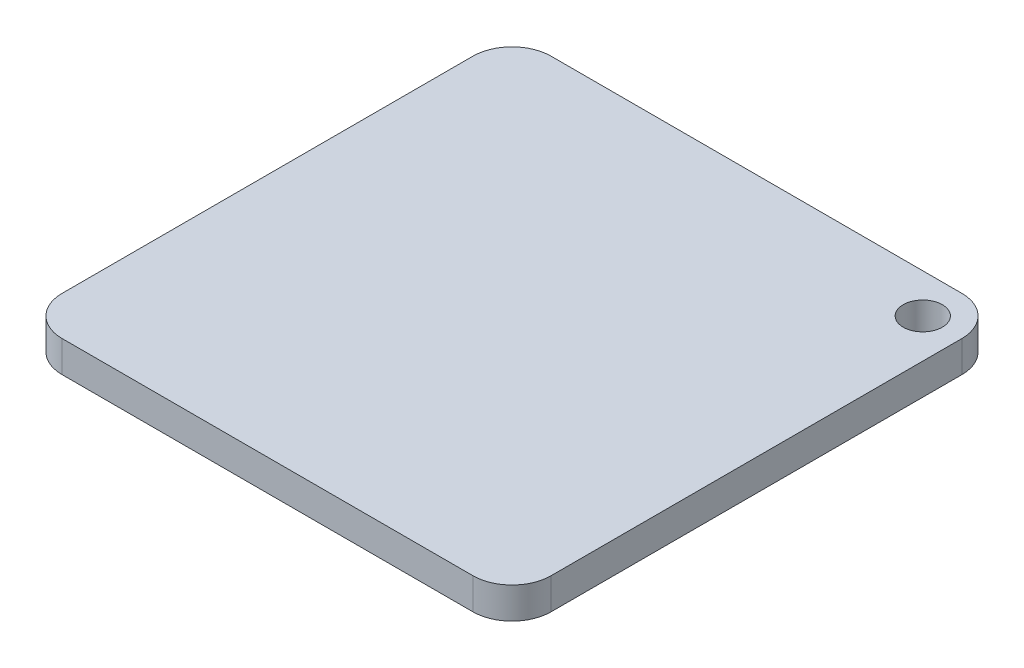
from build123d import *

# Parameters (mm, degrees)
SKETCH_1_R      = 1
EXTRUDE_1_DEPTH = 1.6


with BuildPart() as part:
    # 草图1 → 凸台-拉伸1 (new body)
    with BuildSketch(Plane(origin=(0, 0, 0), x_dir=(1, 0, 0), z_dir=(0, 1, 0))):
        with BuildLine():
            Line((-10.5, 12.5), (10.5, 12.5))
            ThreePointArc((10.5, 12.5), (11.914213562, 11.914213562), (12.5, 10.5))
            Line((12.5, 10.5), (12.5, -10.5))
            ThreePointArc((12.5, -10.5), (11.914213562, -11.914213562), (10.5, -12.5))
            Line((10.5, -12.5), (-10.5, -12.5))
            ThreePointArc((-10.5, -12.5), (-11.914213562, -11.914213562), (-12.5, -10.5))
            Line((-12.5, -10.5), (-12.5, 10.5))
            ThreePointArc((-12.5, 10.5), (-11.914213562, 11.914213562), (-10.5, 12.5))
        make_face()
        with Locations(Location((10.5, 10.5, 0), (0, 0, 270))):
            Circle(SKETCH_1_R, mode=Mode.SUBTRACT)
    extrude(amount=EXTRUDE_1_DEPTH)


solid = part.part
